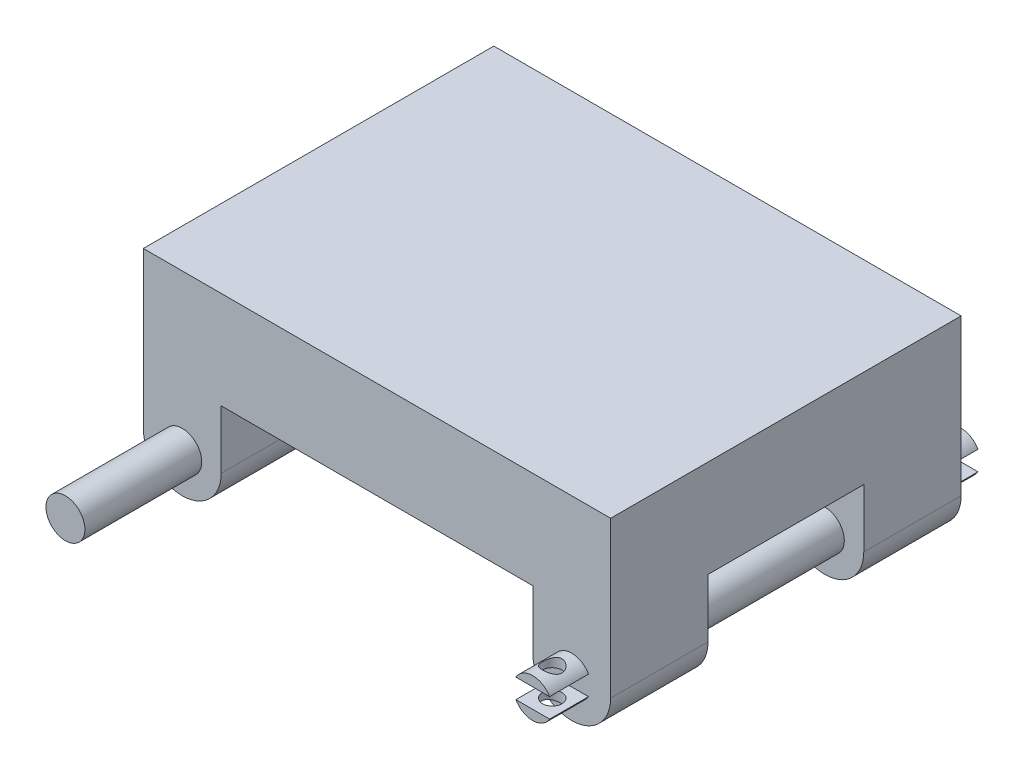
from build123d import *

# Parameters (mm, degrees)
SKETCH1_W                = 609.6
SKETCH1_H                = 457.2
BOSS_EXTRUDE1_DEPTH      = 127
SKETCH2_R                = 50.8
SKETCH2_R_2              = 25.4
BOSS_EXTRUDE2_DEPTH      = 127
BOSS_EXTRUDE3_START      = -127
SKETCH3_R                = 25.4
BOSS_EXTRUDE3_DEPTH      = 127
BOSS_EXTRUDE4_DEPTH      = 50.8
BOSS_EXTRUDE4_DEPTH_BACK = 508
SKETCH5_R                = 25.4
SKETCH6_R                = 12.7
CUT_EXTRUDE1_DEPTH       = 486.266318633
CUT_EXTRUDE2_DEPTH       = 101.6
SKETCH8_R                = 25.4
BOSS_EXTRUDE5_DEPTH      = 101.6
BOSS_EXTRUDE6_START      = 101.6
SKETCH9_R                = 25.4
BOSS_EXTRUDE6_DEPTH      = 101.6


with BuildPart() as part:
    # Sketch1 → Boss-Extrude1 (new body)
    with BuildSketch(Plane(origin=(0, 0, 0), x_dir=(1, 0, 0), z_dir=(0, 1, 0))):
        Rectangle(SKETCH1_W, SKETCH1_H)
    extrude(amount=BOSS_EXTRUDE1_DEPTH)

    # Sketch2 → Boss-Extrude2 (add)
    # profile 1 of 4: a face of its own
    with BuildSketch(Plane.XY.offset(228.6)):
        with BuildLine():
            Line((-203.2, -76.2), (-203.2, 0))
            Line((-203.2, 0), (-304.8, 0))
            Line((-304.8, 0), (-304.8, -76.2))
            ThreePointArc((-304.8, -76.2), (-254, -25.4), (-203.2, -76.2))
        make_face()
    # profile 2 of 4: a face of its own
    with BuildSketch(Plane.XY.offset(228.6)):
        with Locations((-254, -76.2)):
            Circle(SKETCH2_R)
        with Locations((-254, -76.2)):
            Circle(SKETCH2_R_2, mode=Mode.SUBTRACT)
    # profile 3 of 4: a face of its own
    with BuildSketch(Plane.XY.offset(228.6)):
        with Locations((254, -76.2)):
            Circle(SKETCH2_R)
        with Locations((254, -76.2)):
            Circle(SKETCH2_R_2, mode=Mode.SUBTRACT)
    # profile 4 of 4: a face of its own
    with BuildSketch(Plane.XY.offset(228.6)):
        with BuildLine():
            Line((304.8, -76.2), (304.8, 0))
            Line((304.8, 0), (203.2, 0))
            Line((203.2, 0), (203.2, -76.2))
            ThreePointArc((203.2, -76.2), (254, -25.4), (304.8, -76.2))
        make_face()
    extrude(amount=-BOSS_EXTRUDE2_DEPTH)

    # Sketch3 → Boss-Extrude3 (add)
    # profile 1 of 2: a face of its own
    with BuildSketch(Plane(origin=(0, 0, -228.6), x_dir=(-1, 0, 0), z_dir=(0, 0, -1)).offset(BOSS_EXTRUDE3_START)):
        with BuildLine():
            Line((-203.2, -76.2), (-203.2, 0))
            Line((-203.2, 0), (-304.8, 0))
            Line((-304.8, 0), (-304.8, -76.2))
            ThreePointArc((-304.8, -76.2), (-254, -127), (-203.2, -76.2))
        make_face()
        with Locations(Location((-254, -76.2, 0), (0, 0, 180))):
            Circle(SKETCH3_R, mode=Mode.SUBTRACT)
    # profile 2 of 2: a face of its own
    with BuildSketch(Plane(origin=(0, 0, -228.6), x_dir=(-1, 0, 0), z_dir=(0, 0, -1)).offset(BOSS_EXTRUDE3_START)):
        with BuildLine():
            Line((304.8, -76.2), (304.8, 0))
            Line((304.8, 0), (203.2, 0))
            Line((203.2, 0), (203.2, -76.2))
            ThreePointArc((203.2, -76.2), (254, -127), (304.8, -76.2))
        make_face()
        with Locations(Location((254, -76.2, 0), (0, 0, 180))):
            Circle(SKETCH3_R, mode=Mode.SUBTRACT)
    extrude(amount=BOSS_EXTRUDE3_DEPTH)

    # Sketch5 → Boss-Extrude4 (add, two sides: drawn at the far end of the back side and taken through both)
    with BuildSketch(Plane.XY.offset(228.6).offset(-BOSS_EXTRUDE4_DEPTH_BACK)):
        with Locations((254, -76.2)):
            Circle(SKETCH5_R)
        with Locations((-254, -76.2)):
            Circle(SKETCH5_R)
    extrude(amount=BOSS_EXTRUDE4_DEPTH + BOSS_EXTRUDE4_DEPTH_BACK)

    # Sketch6 → Cut-Extrude1 (cut, through all)
    with BuildSketch(Plane(origin=(0, 127, 0), x_dir=(1, 0, 0), z_dir=(0, 1, 0))):
        with Locations(Location((254, -254, 0), (0, 0, 270))):
            Circle(SKETCH6_R)
        with Locations(Location((254, 254, 0), (0, 0, 270))):
            Circle(SKETCH6_R)
    extrude(amount=-CUT_EXTRUDE1_DEPTH, mode=Mode.SUBTRACT)

    # Sketch7 → Cut-Extrude2 (cut)
    with BuildSketch(Plane(origin=(304.8, 0, 0), x_dir=(0, 0, -1), z_dir=(1, 0, 0))):
        Polygon((-228.6, -63.5), (-330.2, -63.5), (-330.2, -88.9), (-228.6, -88.9), (-228.6, -76.2), align=None)
        Polygon((279.4, -88.9), (279.4, -63.5), (228.6, -63.5), (228.6, -76.2), (228.6, -88.9), align=None)
    extrude(amount=-CUT_EXTRUDE2_DEPTH, mode=Mode.SUBTRACT)

    # Sketch8 → Boss-Extrude5 (add)
    with BuildSketch(Plane(origin=(0, 0, -279.4), x_dir=(-1, 0, 0), z_dir=(0, 0, -1))):
        with Locations(Location((254, -76.2, 0), (0, 0, 180))):
            Circle(SKETCH8_R)
    extrude(amount=BOSS_EXTRUDE5_DEPTH)

    # Sketch9 → Boss-Extrude6 (add)
    with BuildSketch(Plane.XY.offset(279.4).offset(BOSS_EXTRUDE6_START)):
        with Locations((-254, -76.2)):
            Circle(SKETCH9_R)
    extrude(amount=-BOSS_EXTRUDE6_DEPTH)


solid = part.part
